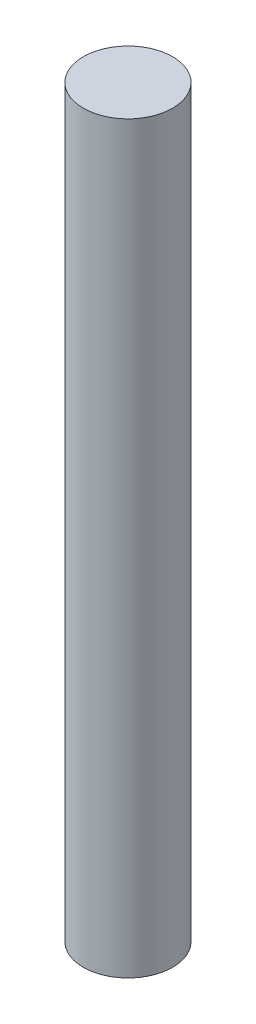
from build123d import *

# Parameters (mm, degrees)
SKETCH1_R           = 1.8
BOSS_EXTRUDE1_DEPTH = 30


with BuildPart() as part:
    # Sketch1 → Boss-Extrude1 (new body)
    with BuildSketch(Plane(origin=(0, 0, 0), x_dir=(1, 0, 0), z_dir=(0, 1, 0))):
        with Locations(Location((0, 0, 0), (0, 0, 270))):
            Circle(SKETCH1_R)
    extrude(amount=BOSS_EXTRUDE1_DEPTH)


solid = part.part
